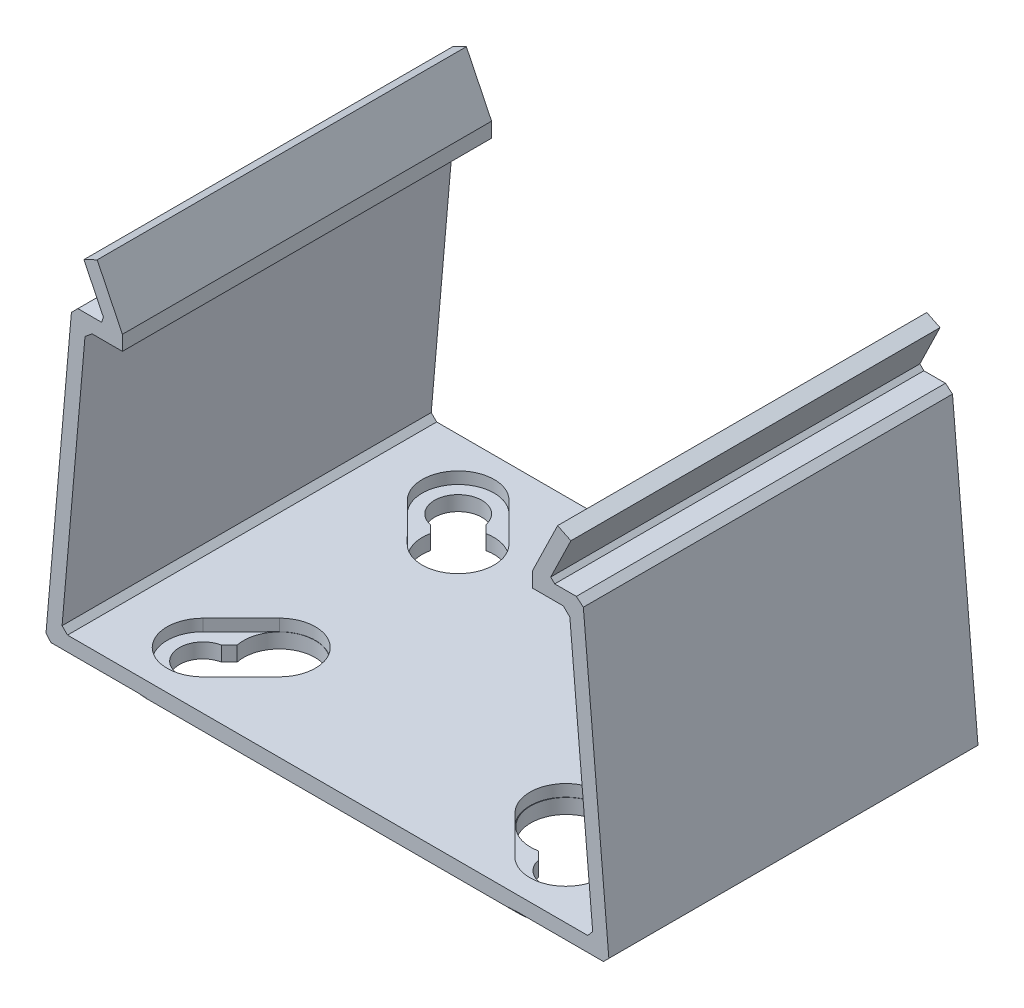
from build123d import *
from OCP.BRepFilletAPI import BRepFilletAPI_MakeChamfer

# Parameters (mm, degrees)
BOSS_EXTRUDE1_DEPTH = 50
SKETCH5_W           = 63
SKETCH5_H           = 50
BOSS_EXTRUDE2_DEPTH = 1.6
CHAMFER6_SIZE       = 0.8
CHAMFER6_SIZE2      = 0.738449877
CHAMFER7_SIZE       = 0.8
CHAMFER7_SIZE2      = 0.880050294
CHAMFER7_SIZE2_2    = 0.59857957
FILLET1_R           = 7
CHAMFER10_SIZE      = 1.5
CUT_EXTRUDE5_REACH  = 79.922
CUT_EXTRUDE6_DEPTH  = 1.6


with BuildPart() as part:
    # Sketch1 → Boss-Extrude1 (new body)
    with BuildSketch(Plane.XY):
        Polygon((-34.595581798, 39), (-29.986555798, 39), (-32.97810591, 45.15618727), (-31.179250624, 46.030326652), (-27.76291945, 39), (-27.76291945, 37), (-32.76291945, 37), (-36, 0), (0, 0), (36, 0), (32.76291945, 37), (27.76291945, 37), (27.76291945, 39), (31.179250624, 46.030326652), (32.97810591, 45.15618727), (29.986555798, 39), (34.595581798, 39), (38.182617002, -2), (0, -2), (-38.182617002, -2), align=None)
    extrude(amount=BOSS_EXTRUDE1_DEPTH)

    # Sketch5 → Boss-Extrude2 (add)
    with BuildSketch(Plane.XZ.offset(2)):
        with Locations((0, 25)):
            Rectangle(SKETCH5_W, SKETCH5_H)
    extrude(amount=BOSS_EXTRUDE2_DEPTH)

    # Chamfer6: one chamfer whose edges measure the first distance from different faces: ONE call of the kernel's chamfer builder (chamfer() names one face for all edges)
    chamfer6_edges_1 = [part.edges().sort_by_distance(p)[0] for p in [
        (-36, 0, 25),
    ]]
    chamfer6_side_1 = [part.faces().sort_by_distance(p)[0] for p in [
        (0, 0, 25),
    ]]
    chamfer6_edges_2 = [part.edges().sort_by_distance(p)[0] for p in [
        (36, 0, 25),
    ]]
    chamfer6_side_2 = [part.faces().sort_by_distance(p)[0] for p in [
        (34.381459725, 18.5, 25),
    ]]
    chamfer6_edges_3 = [part.edges().sort_by_distance(p)[0] for p in [
        (38.182617002, -2, 25),
    ]]
    chamfer6_side_3 = [part.faces().sort_by_distance(p)[0] for p in [
        (34.841308501, -2, 25),
    ]]
    chamfer6_edges_4 = [part.edges().sort_by_distance(p)[0] for p in [
        (-38.182617002, -2, 25),
    ]]
    chamfer6_side_4 = [part.faces().sort_by_distance(p)[0] for p in [
        (-36.3890994, 18.5, 25),
    ]]
    chamfer6 = BRepFilletAPI_MakeChamfer(part.part.solid().wrapped)
    for e in chamfer6_edges_1:
        chamfer6.Add(CHAMFER6_SIZE, CHAMFER6_SIZE2, e.wrapped, chamfer6_side_1[0].wrapped)  # the first distance lies on this face
    for e in chamfer6_edges_2:
        chamfer6.Add(CHAMFER6_SIZE, CHAMFER6_SIZE2, e.wrapped, chamfer6_side_2[0].wrapped)  # the first distance lies on this face
    for e in chamfer6_edges_3:
        chamfer6.Add(CHAMFER6_SIZE, CHAMFER6_SIZE2, e.wrapped, chamfer6_side_3[0].wrapped)  # the first distance lies on this face
    for e in chamfer6_edges_4:
        chamfer6.Add(CHAMFER6_SIZE, CHAMFER6_SIZE2, e.wrapped, chamfer6_side_4[0].wrapped)  # the first distance lies on this face
    add(Compound.cast(chamfer6.Shape()), mode=Mode.REPLACE)

    # Chamfer7: one chamfer whose edges measure the first distance from different faces: ONE call of the kernel's chamfer builder (chamfer() names one face for all edges)
    chamfer7_edges_1 = [part.edges().sort_by_distance(p)[0] for p in [
        (-32.76291945, 37, 25),
    ]]
    chamfer7_side_1 = [part.faces().sort_by_distance(p)[0] for p in [
        (-34.349279651, 18.867819926, 25),
    ]]
    chamfer7_edges_2 = [part.edges().sort_by_distance(p)[0] for p in [
        (32.76291945, 37, 25),
    ]]
    chamfer7_side_2 = [part.faces().sort_by_distance(p)[0] for p in [
        (30.26291945, 37, 25),
    ]]
    chamfer7_edges_3 = [part.edges().sort_by_distance(p)[0] for p in [
        (29.986555798, 39, 25),
    ]]
    chamfer7_side_3 = [part.faces().sort_by_distance(p)[0] for p in [
        (32.291068798, 39, 25),
    ]]
    chamfer7_edges_4 = [part.edges().sort_by_distance(p)[0] for p in [
        (34.595581798, 39, 25),
    ]]
    chamfer7_side_4 = [part.faces().sort_by_distance(p)[0] for p in [
        (36.356919326, 18.867819926, 25),
    ]]
    chamfer7_edges_5 = [part.edges().sort_by_distance(p)[0] for p in [
        (-34.595581798, 39, 25),
    ]]
    chamfer7_side_5 = [part.faces().sort_by_distance(p)[0] for p in [
        (-32.291068798, 39, 25),
    ]]
    chamfer7_edges_6 = [part.edges().sort_by_distance(p)[0] for p in [
        (-29.986555798, 39, 25),
    ]]
    chamfer7_side_6 = [part.faces().sort_by_distance(p)[0] for p in [
        (-31.482330854, 42.078093635, 25),
    ]]
    chamfer7 = BRepFilletAPI_MakeChamfer(part.part.solid().wrapped)
    for e in chamfer7_edges_1:
        chamfer7.Add(CHAMFER7_SIZE, CHAMFER7_SIZE2, e.wrapped, chamfer7_side_1[0].wrapped)  # the first distance lies on this face
    for e in chamfer7_edges_2:
        chamfer7.Add(CHAMFER7_SIZE, CHAMFER7_SIZE2, e.wrapped, chamfer7_side_2[0].wrapped)  # the first distance lies on this face
    for e in chamfer7_edges_3:
        chamfer7.Add(CHAMFER7_SIZE, CHAMFER7_SIZE2_2, e.wrapped, chamfer7_side_3[0].wrapped)  # the first distance lies on this face
    for e in chamfer7_edges_4:
        chamfer7.Add(CHAMFER7_SIZE, CHAMFER7_SIZE2, e.wrapped, chamfer7_side_4[0].wrapped)  # the first distance lies on this face
    for e in chamfer7_edges_5:
        chamfer7.Add(CHAMFER7_SIZE, CHAMFER7_SIZE2, e.wrapped, chamfer7_side_5[0].wrapped)  # the first distance lies on this face
    for e in chamfer7_edges_6:
        chamfer7.Add(CHAMFER7_SIZE, CHAMFER7_SIZE2_2, e.wrapped, chamfer7_side_6[0].wrapped)  # the first distance lies on this face
    add(Compound.cast(chamfer7.Shape()), mode=Mode.REPLACE)

    # Fillet1
    fillet1_edges = [part.edges().sort_by_distance(p)[0] for p in [
        (-31.5, -2.8, 0),
        (31.5, -2.8, 0),
        (31.5, -2.8, 50),
        (-31.5, -2.8, 50),
    ]]
    fillet(fillet1_edges, radius=FILLET1_R)

    # Chamfer10
    chamfer10_edges = [part.edges().sort_by_distance(p)[0] for p in [
        (-31.5, -3.6, 25),
        (0, -3.6, 50),
        (0, -3.6, 0),
        (31.5, -3.6, 25),
        (29.449747468, -3.6, 47.949747468),
        (29.449747468, -3.6, 2.050252532),
        (-29.449747468, -3.6, 2.050252532),
        (-29.449747468, -3.6, 47.949747468),
    ]]
    chamfer(chamfer10_edges, length=CHAMFER10_SIZE)

    # Sketch15 → Cut-Extrude5 (cut, up to next)
    with BuildSketch(Plane(origin=(0, 0, 0), x_dir=(1, 0, 0), z_dir=(0, 1, 0)), mode=Mode.PRIVATE) as cut_extrude5_sk1:
        with BuildLine():
            Line((21.475016583, -42.866268583), (20.428249938, -41.819501939))
            ThreePointArc((20.428249938, -41.819501939), (16.022847213, -33.655561292), (24.186787861, -38.060964016))
            Line((24.186787861, -38.060964016), (25.233554505, -39.107730661))
            ThreePointArc((25.233554505, -39.107730661), (26.877324102, -44.51003818), (21.475016583, -42.866268583))
        make_face()
    cut_extrude5_tool1 = extrude(cut_extrude5_sk1.sketch, amount=-CUT_EXTRUDE5_REACH, mode=Mode.PRIVATE) & part.part
    # Sketch15 → Cut-Extrude5 (cut, up to next)
    with BuildSketch(Plane(origin=(0, 0, 0), x_dir=(1, 0, 0), z_dir=(0, 1, 0)), mode=Mode.PRIVATE) as cut_extrude5_sk2:
        with BuildLine():
            Line((-25.185393692, -39.138763585), (-24.139916413, -38.090709162))
            ThreePointArc((-24.139916413, -38.090709162), (-15.98140501, -33.675259948), (-20.37675457, -41.844617469))
            Line((-20.37675457, -41.844617469), (-21.422231849, -42.892671893))
            ThreePointArc((-21.422231849, -42.892671893), (-26.822511792, -44.543090495), (-25.185393692, -39.138763585))
        make_face()
    cut_extrude5_tool2 = extrude(cut_extrude5_sk2.sketch, amount=-CUT_EXTRUDE5_REACH, mode=Mode.PRIVATE) & part.part
    # Sketch15 → Cut-Extrude5 (cut, up to next)
    with BuildSketch(Plane(origin=(0, 0, 0), x_dir=(1, 0, 0), z_dir=(0, 1, 0)), mode=Mode.PRIVATE) as cut_extrude5_sk3:
        with BuildLine():
            Line((25.233554505, -10.892269339), (24.186787861, -11.939035984))
            ThreePointArc((24.186787861, -11.939035984), (16.022847213, -16.344438708), (20.428249938, -8.180498061))
            Line((20.428249938, -8.180498061), (21.475016583, -7.133731417))
            ThreePointArc((21.475016583, -7.133731417), (26.877324102, -5.48996182), (25.233554505, -10.892269339))
        make_face()
    cut_extrude5_tool3 = extrude(cut_extrude5_sk3.sketch, amount=-CUT_EXTRUDE5_REACH, mode=Mode.PRIVATE) & part.part
    # Sketch15 → Cut-Extrude5 (cut, up to next)
    with BuildSketch(Plane(origin=(0, 0, 0), x_dir=(1, 0, 0), z_dir=(0, 1, 0)), mode=Mode.PRIVATE) as cut_extrude5_sk4:
        with BuildLine():
            Line((-21.422231849, -7.107328107), (-20.37675457, -8.155382531))
            ThreePointArc((-20.37675457, -8.155382531), (-15.98140501, -16.324740052), (-24.139916413, -11.909290838))
            Line((-24.139916413, -11.909290838), (-25.185393692, -10.861236415))
            ThreePointArc((-25.185393692, -10.861236415), (-26.822511792, -5.456909505), (-21.422231849, -7.107328107))
        make_face()
    cut_extrude5_tool4 = extrude(cut_extrude5_sk4.sketch, amount=-CUT_EXTRUDE5_REACH, mode=Mode.PRIVATE) & part.part
    add(cut_extrude5_tool1.solids().sort_by_distance((21.014912, 0, 38.647626))[0], mode=Mode.SUBTRACT)
    add(cut_extrude5_tool2.solids().sort_by_distance((-20.96732, 0, 38.673466))[0], mode=Mode.SUBTRACT)
    add(cut_extrude5_tool3.solids().sort_by_distance((21.014912, 0, 11.352374))[0], mode=Mode.SUBTRACT)
    add(cut_extrude5_tool4.solids().sort_by_distance((-20.96732, 0, 11.326534))[0], mode=Mode.SUBTRACT)

    # Sketch16 → Cut-Extrude6 (cut)
    with BuildSketch(Plane(origin=(0, 0, 0), x_dir=(1, 0, 0), z_dir=(0, 1, 0))):
        with BuildLine():
            Line((-15.951616609, -40.543181032), (-21.113676241, -45.71796535))
            ThreePointArc((-21.113676241, -45.71796535), (-28.002957525, -45.726446075), (-28.011438251, -38.837164791))
            Line((-28.011438251, -38.837164791), (-22.849378618, -33.662380473))
            ThreePointArc((-22.849378618, -33.662380473), (-15.960097334, -33.653899748), (-15.951616609, -40.543181032))
        make_face()
        with BuildLine():
            Line((-15.951616609, -9.456818968), (-21.113676241, -4.28203465))
            ThreePointArc((-21.113676241, -4.28203465), (-28.002957525, -4.273553925), (-28.011438251, -11.162835209))
            Line((-28.011438251, -11.162835209), (-22.849378618, -16.337619527))
            ThreePointArc((-22.849378618, -16.337619527), (-15.960097334, -16.346100252), (-15.951616609, -9.456818968))
        make_face()
        with BuildLine():
            Line((15.951616609, -40.543181032), (21.113676241, -45.71796535))
            ThreePointArc((21.113676241, -45.71796535), (28.002957525, -45.726446075), (28.011438251, -38.837164791))
            Line((28.011438251, -38.837164791), (22.849378618, -33.662380473))
            ThreePointArc((22.849378618, -33.662380473), (15.960097334, -33.653899748), (15.951616609, -40.543181032))
        make_face()
        with BuildLine():
            Line((15.951616609, -9.456818968), (21.113676241, -4.28203465))
            ThreePointArc((21.113676241, -4.28203465), (28.002957525, -4.273553925), (28.011438251, -11.162835209))
            Line((28.011438251, -11.162835209), (22.849378618, -16.337619527))
            ThreePointArc((22.849378618, -16.337619527), (15.960097334, -16.346100252), (15.951616609, -9.456818968))
        make_face()
    extrude(amount=-CUT_EXTRUDE6_DEPTH, mode=Mode.SUBTRACT)


solid = part.part
